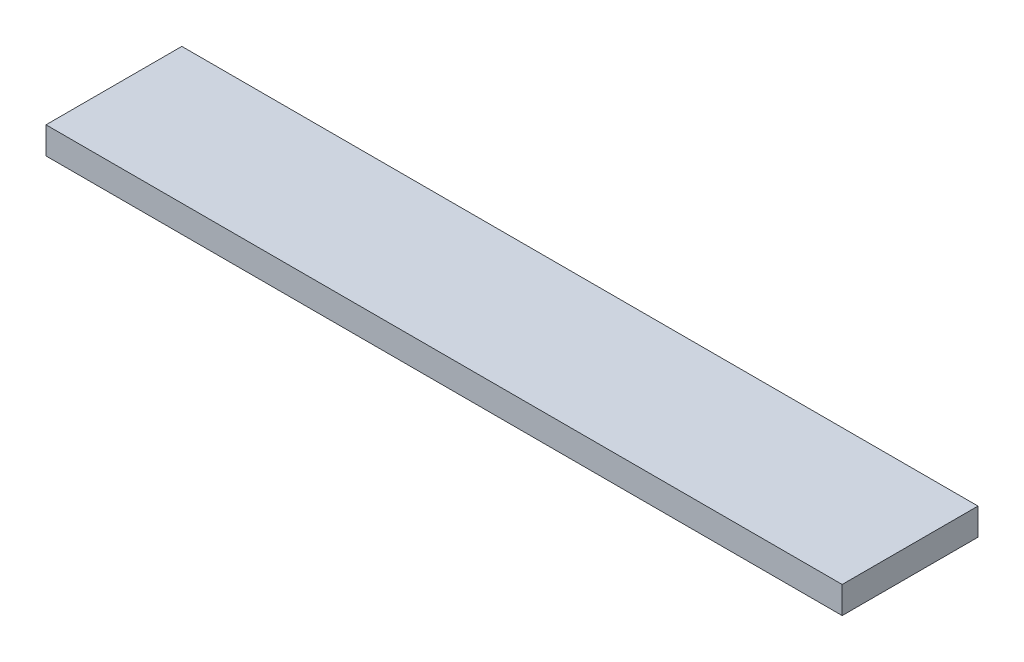
from build123d import *

# Parameters (mm, degrees)
SKETCH1_W           = 236
SKETCH1_H           = 40.26
BOSS_EXTRUDE1_DEPTH = 8


with BuildPart() as part:
    # Sketch1 → Boss-Extrude1 (new body)
    with BuildSketch(Plane(origin=(0, 0, 0), x_dir=(1, 0, 0), z_dir=(0, 1, 0))):
        with Locations((118, 20.13)):
            Rectangle(SKETCH1_W, SKETCH1_H)
    extrude(amount=BOSS_EXTRUDE1_DEPTH)


solid = part.part
